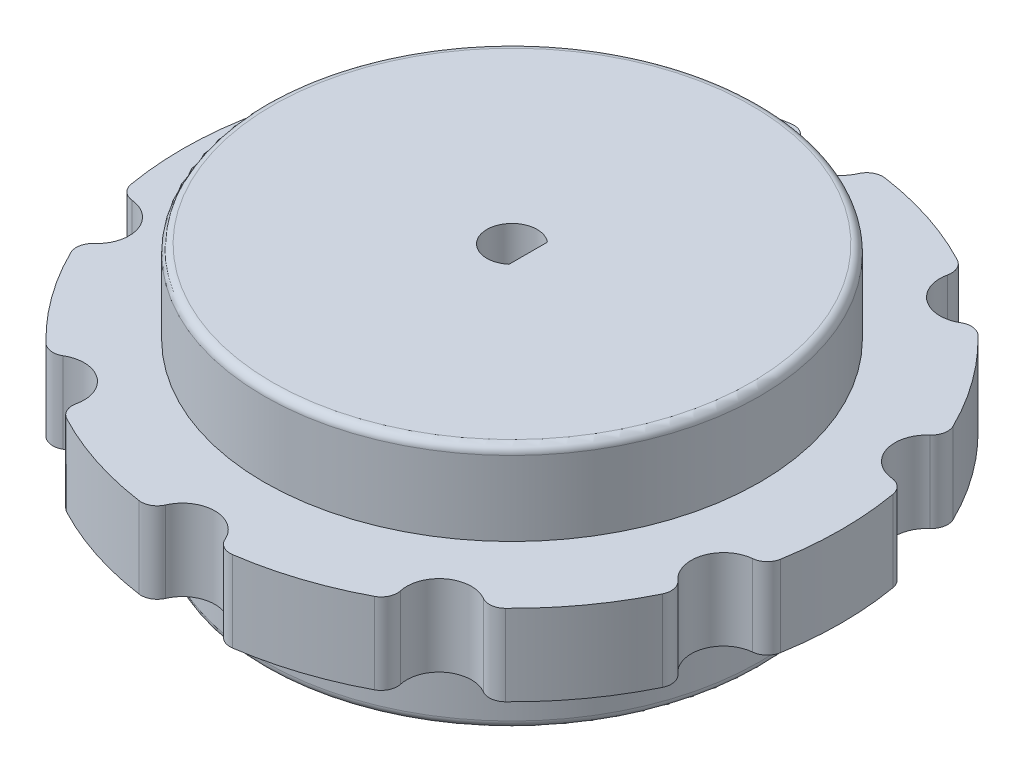
from build123d import *

# Parameters (mm, degrees)
SKETCH_1_R                       = 15.3
SKETCH_1_R_2                     = 13.7
EXTRUDE_1_DEPTH                  = 7.6
SKETCH_1_3_R                     = 20.35
EXTRUDE_2_DEPTH                  = 2.5
SKETCH_1_4_R                     = 2
CUT_EXTRUDE_1_DEPTH              = 30.765836121
FILLET_1_R                       = 1
PATTERN_CIRCULAR_1_COUNT         = 10
FILLET_1_OF_PATTERN_CIRCULAR_1_R = 1
FILLET_2_R                       = 0.5
SKETCH_1_5_R                     = 13.7
EXTRUDE_3_DEPTH                  = 3.9
EXTRUDE_START                    = -7.6
SKETCH_1_6_R                     = 13.7
EXTRUDE_5_DEPTH                  = 15.2
CUT_EXTRUDE_3_DEPTH              = 33.42412133


with BuildPart() as part:
    # 草图1 → 凸台-拉伸1 (new, symmetric)
    with BuildSketch(Plane(origin=(0, 0, 0), x_dir=(1, 0, 0), z_dir=(0, 1, 0))):
        with Locations(Location((0, 0, 0), (0, 0, 90))):
            Circle(SKETCH_1_R)
        with Locations(Location((0, 0, 0), (0, 0, 90))):
            Circle(SKETCH_1_R_2, mode=Mode.SUBTRACT)
    extrude(amount=EXTRUDE_1_DEPTH, both=True)

    # 草图1<3> → 凸台-拉伸2 (add, symmetric)
    with BuildSketch(Plane(origin=(0, 0, 0), x_dir=(1, 0, 0), z_dir=(0, 1, 0))):
        with Locations(Location((0, 0, 0), (0, 0, 270))):
            Circle(SKETCH_1_3_R)
    extrude(amount=EXTRUDE_2_DEPTH, both=True)

    # 草图1<4> → 切除-拉伸1 (cut, symmetric)
    with BuildSketch(Plane(origin=(0, 0, 0), x_dir=(1, 0, 0), z_dir=(0, 1, 0))):
        with Locations((0, 20.35)):
            Circle(SKETCH_1_4_R)
    cut_extrude_1 = extrude(amount=CUT_EXTRUDE_1_DEPTH, both=True, mode=Mode.SUBTRACT)

    # 圆角1
    fillet_1_edges = [part.edges().sort_by_distance(p)[0] for p in [
        (-1.997583796, 0, -20.251719902),
        (1.997583796, 0, -20.251719902),
    ]]
    fillet(fillet_1_edges, radius=FILLET_1_R)

    # 阵列(圆周)1: 切除-拉伸1 ×10 about axis
    pattern_circular_1_axis = Axis((0, 0, 0), (0, 1, 0))
    for i in range(1, PATTERN_CIRCULAR_1_COUNT):
        add(cut_extrude_1.rotate(pattern_circular_1_axis, i * 360 / PATTERN_CIRCULAR_1_COUNT), mode=Mode.SUBTRACT)

    # 圆角1 of 阵列(圆周)1
    fillet_1_of_pattern_circular_1_edges = [part.edges().sort_by_distance(p)[0] for p in [
        (-13.51974153, 0, -15.20983527),
        (-10.287583053, 0, -17.558135861),
        (-19.877817519, 0, -4.358310529),
        (-18.643242838, 0, -8.157940701),
        (-18.643242838, 0, 8.157940701),
        (-19.877817519, 0, 4.358310529),
        (-10.287583053, 0, 17.558135861),
        (-13.51974153, 0, 15.20983527),
        (1.997583796, 0, 20.251719902),
        (-1.997583796, 0, 20.251719902),
        (13.51974153, 0, 15.20983527),
        (10.287583053, 0, 17.558135861),
        (19.877817519, 0, 4.358310529),
        (18.643242838, 0, 8.157940701),
        (18.643242838, 0, -8.157940701),
        (19.877817519, 0, -4.358310529),
        (10.287583053, 0, -17.558135861),
        (13.51974153, 0, -15.20983527),
    ]]
    fillet(fillet_1_of_pattern_circular_1_edges, radius=FILLET_1_OF_PATTERN_CIRCULAR_1_R)

    # 圆角2
    fillet_2_edges = [part.edges().sort_by_distance(p)[0] for p in [
        (0, -7.6, 15.3),
        (0, 7.6, 15.3),
    ]]
    fillet(fillet_2_edges, radius=FILLET_2_R)

    # 草图1<5> → 凸台-拉伸3 (add, symmetric)
    with BuildSketch(Plane(origin=(0, 0, 0), x_dir=(1, 0, 0), z_dir=(0, 1, 0))):
        with Locations(Location((0, 0, 0), (0, 0, 90))):
            Circle(SKETCH_1_5_R)
    extrude(amount=EXTRUDE_3_DEPTH, both=True)

    # 草图1<6> → 凸台-拉伸5 (add)
    with BuildSketch(Plane(origin=(0, 0, 0), x_dir=(1, 0, 0), z_dir=(0, 1, 0)).offset(EXTRUDE_START)):
        Circle(SKETCH_1_6_R)
    extrude(amount=EXTRUDE_5_DEPTH)

    # 草图4 → 切除-拉伸3 (cut, through all)
    with BuildSketch(Plane.XZ.offset(7.6)):
        with BuildLine():
            Line((1, -1.184271928), (1, 1.184271928))
            ThreePointArc((1, 1.184271928), (-1.55, 0), (1, -1.184271928))
        make_face()
    extrude(amount=-CUT_EXTRUDE_3_DEPTH, mode=Mode.SUBTRACT)


solid = part.part
